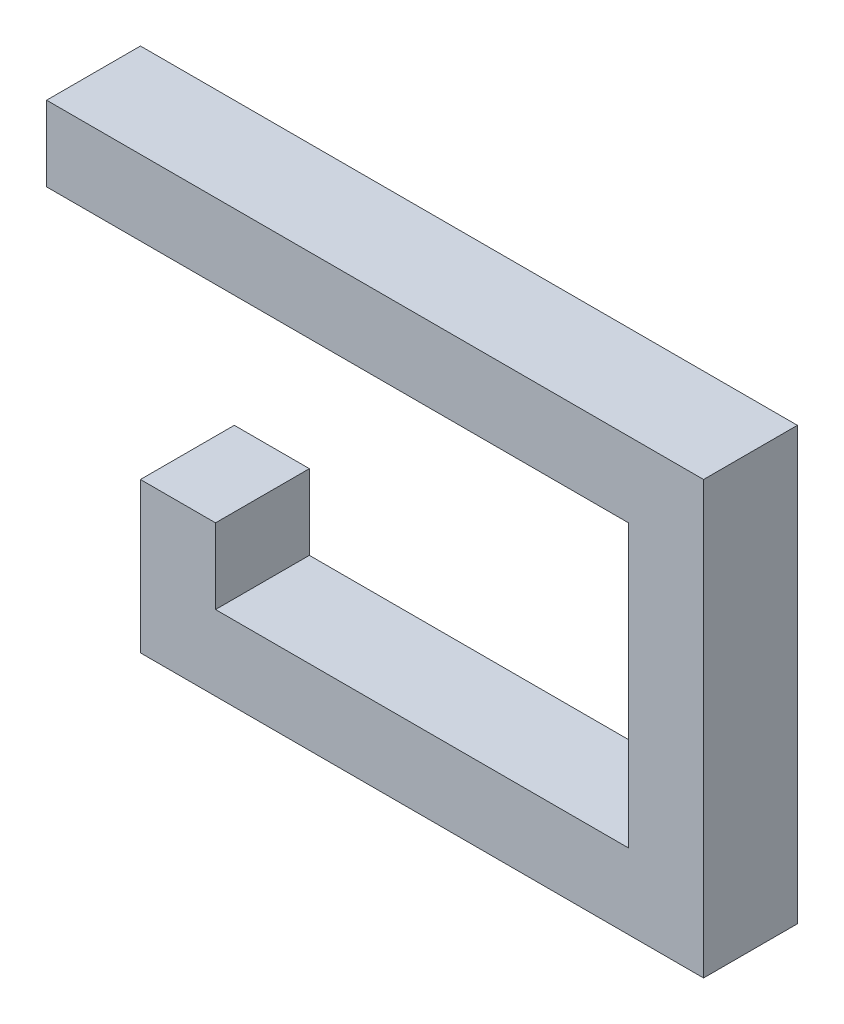
from build123d import *

# Parameters (mm, degrees)
BOSS_EXTRUDE1_DEPTH = 2.5


with BuildPart() as part:
    # Sketch1 → Boss-Extrude1 (new body)
    with BuildSketch(Plane.XY):
        Polygon((0, 0), (15, 0), (15, 11.5), (-2.5, 11.5), (-2.5, 9.5), (13, 9.5), (13, 2), (2, 2), (2, 4), (0, 4), (0, 2), align=None)
    extrude(amount=BOSS_EXTRUDE1_DEPTH)


solid = part.part
